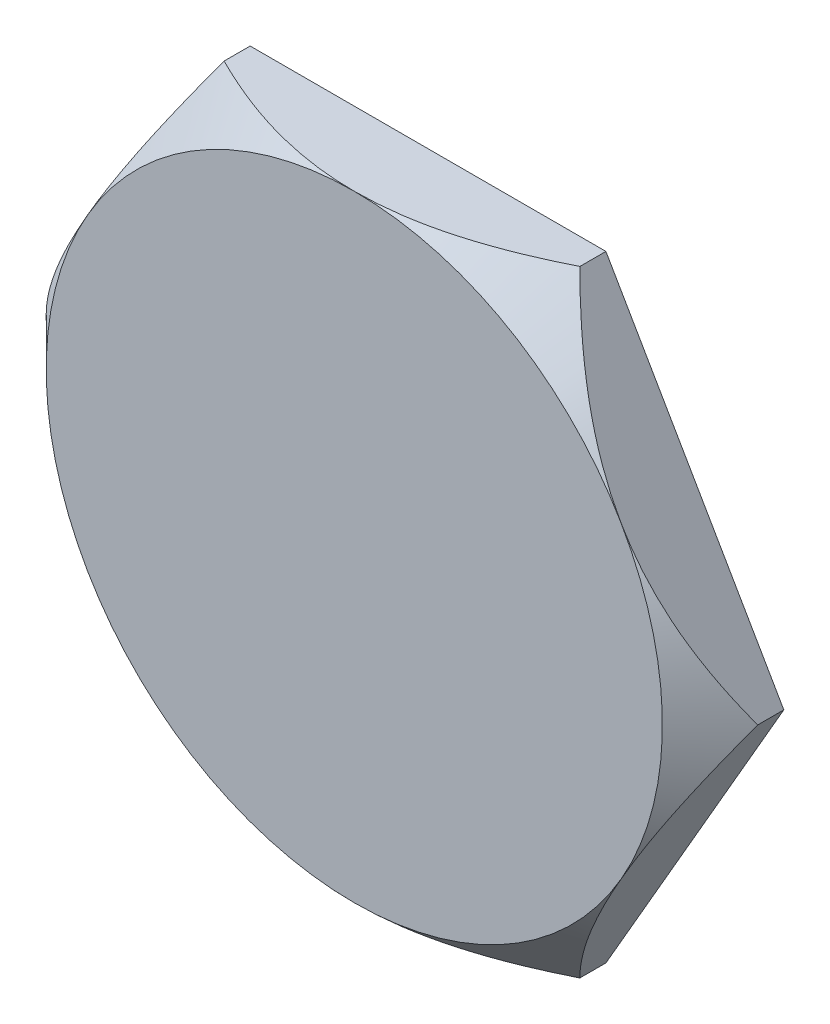
from build123d import *

# Parameters (mm, degrees)
BOSS_EXTRUDE1_DEPTH = 4.5
SKETCH2_OUTSIDE_W   = 230.192
SKETCH2_OUTSIDE_H   = 218.556
SKETCH2_OUTSIDE_R   = 37.607090764
CUT_EXTRUDE1_DEPTH  = 59.146518755
CUT_EXTRUDE1_DRAFT  = -45


with BuildPart() as part:
    # Sketch1 → Boss-Extrude1 (new, symmetric)
    with BuildSketch(Plane.XY):
        Polygon((21.712463976, -37.607090764), (43.424927952, 0), (21.712463976, 37.607090764), (-21.712463976, 37.607090764), (-43.424927952, 0), (-21.712463976, -37.607090764), align=None)
    extrude(amount=BOSS_EXTRUDE1_DEPTH, both=True)


with BuildPart() as cut_extrude1_tool:
    # Sketch2 outside → Cut-Extrude1 (with draft: the straight prism first)
    with BuildSketch(Plane.XY.offset(4.5)):
        Rectangle(SKETCH2_OUTSIDE_W, SKETCH2_OUTSIDE_H)
        Circle(SKETCH2_OUTSIDE_R, mode=Mode.SUBTRACT)
    extrude(amount=-CUT_EXTRUDE1_DEPTH)
    # Cut-Extrude1: the draft: its side faces are tilted about the plane it starts from
    cut_extrude1_sides = [cut_extrude1_tool.faces().sort_by_distance(p)[0] for p in [
        (0, -109.278, -25.073259378),
        (115.096, 0, -25.073259378),
        (0, 109.278, -25.073259378),
        (-115.096, 0, -25.073259378),
        (-37.607090764, 0, -25.073259378),
    ]]
    draft(cut_extrude1_sides, Plane.XY.offset(4.5), CUT_EXTRUDE1_DRAFT)


with BuildPart() as part_1:
    add(part.part)

    # Cut-Extrude1: cut by cut_extrude1_tool
    add(cut_extrude1_tool.part, mode=Mode.SUBTRACT)


solid = part_1.part
